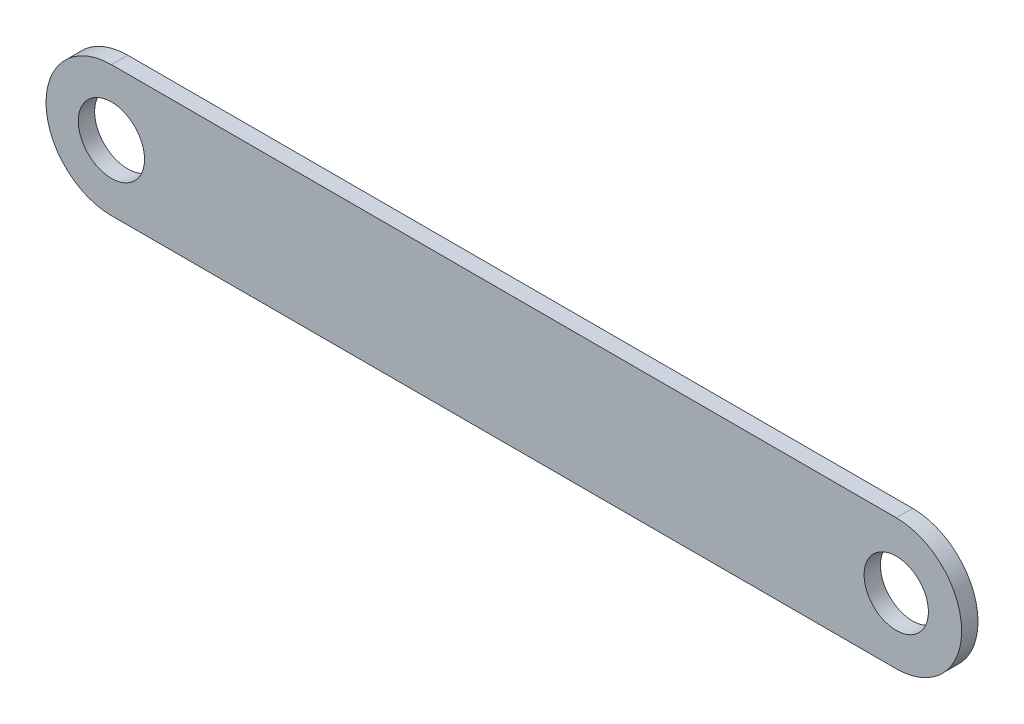
from build123d import *

# Parameters (mm, degrees)
SKETCH1_R           = 6.430069769
SKETCH1_R_2         = 6.247756724
BOSS_EXTRUDE1_DEPTH = 3.175


with BuildPart() as part:
    # Sketch1 → Boss-Extrude1 (new body)
    with BuildSketch(Plane.XY):
        with BuildLine():
            Line((0, 12.7), (152.4, 12.7))
            ThreePointArc((152.4, 12.7), (165.1, 0), (152.4, -12.7))
            Line((152.4, -12.7), (0, -12.7))
            ThreePointArc((0, -12.7), (-12.7, 0), (0, 12.7))
        make_face()
        Circle(SKETCH1_R, mode=Mode.SUBTRACT)
        with Locations((152.4, 0)):
            Circle(SKETCH1_R_2, mode=Mode.SUBTRACT)
    extrude(amount=BOSS_EXTRUDE1_DEPTH)


solid = part.part
